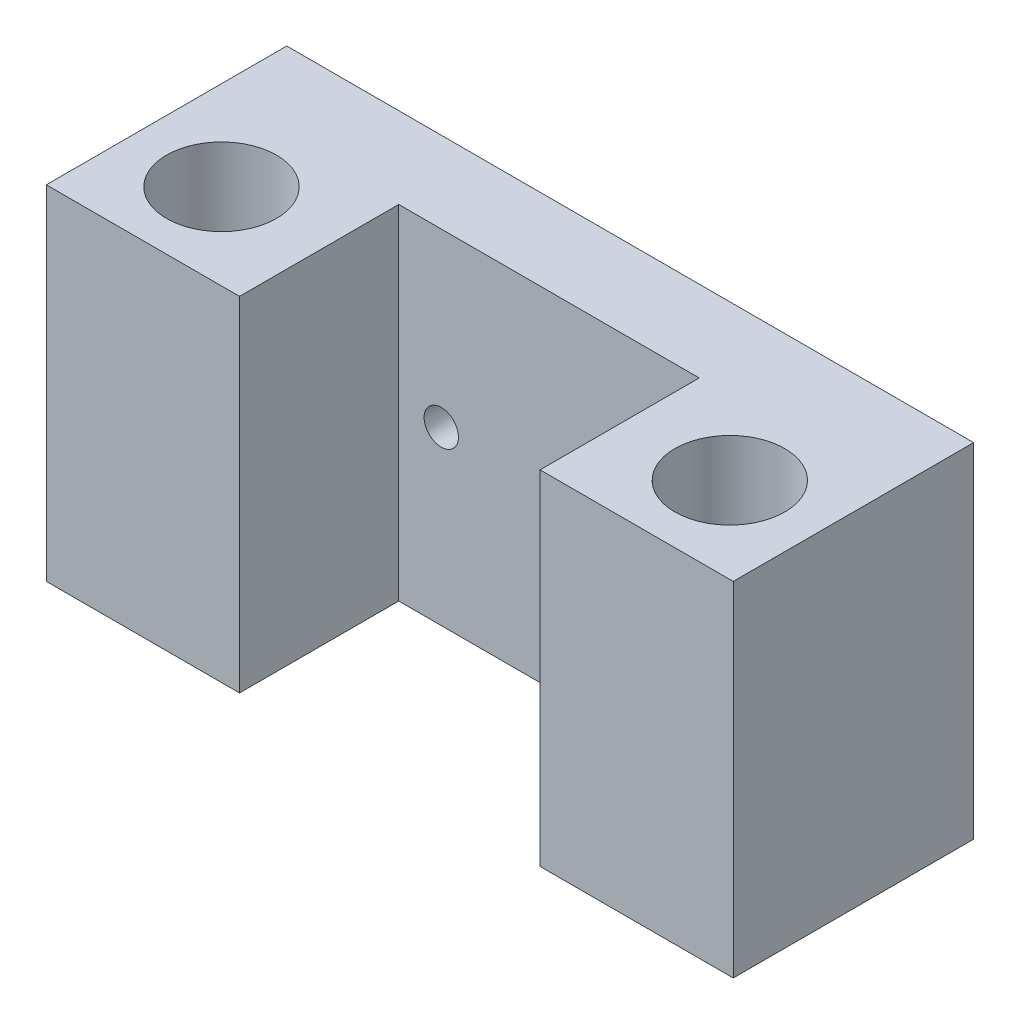
from build123d import *

# Parameters (mm, degrees)
SKETCH3_W           = 100
SKETCH3_H           = 50
BOSS_EXTRUDE1_DEPTH = 25
SKETCH5_R           = 8
SKETCH5_W           = 43.746020772
SKETCH5_H           = 23.175190528
CUT_EXTRUDE1_DEPTH  = 76
SKETCH7_R           = 2.5
CUT_EXTRUDE4_DEPTH  = 10
BOSS_EXTRUDE2_START = 10
SKETCH8_W           = 100
SKETCH8_H           = 50
SKETCH8_R           = 2.5
BOSS_EXTRUDE2_DEPTH = 10
SKETCH9_R           = 2.5
CUT_EXTRUDE5_DEPTH  = 10


with BuildPart() as part:
    # Sketch3 → Boss-Extrude1 (new body)
    with BuildSketch(Plane.XY):
        Rectangle(SKETCH3_W, SKETCH3_H)
    extrude(amount=BOSS_EXTRUDE1_DEPTH)

    # Sketch5 → Cut-Extrude1 (cut, through all)
    with BuildSketch(Plane(origin=(0, 25, 0), x_dir=(1, 0, 0), z_dir=(0, 1, 0))):
        with Locations(Location((37, -12.5, 0), (0, 0, 270))):
            Circle(SKETCH5_R)
        with Locations(Location((-37, -12.5, 0), (0, 0, 90))):
            Circle(SKETCH5_R)
        with Locations((0, -13.412404736)):
            Rectangle(SKETCH5_W, SKETCH5_H)
    extrude(amount=-CUT_EXTRUDE1_DEPTH, mode=Mode.SUBTRACT)

    # Sketch7 → Cut-Extrude4 (cut)
    with BuildSketch(Plane(origin=(0, 0, 0), x_dir=(-1, 0, 0), z_dir=(0, 0, -1))):
        with Locations((32.5, 9.25)):
            Circle(SKETCH7_R)
        with Locations((32.5, -9.25)):
            Circle(SKETCH7_R)
        with Locations((-32.5, -9.25)):
            Circle(SKETCH7_R)
        with Locations((-32.5, 9.25)):
            Circle(SKETCH7_R)
    extrude(amount=-CUT_EXTRUDE4_DEPTH, mode=Mode.SUBTRACT)

    # Sketch8 → Boss-Extrude2 (add)
    with BuildSketch(Plane(origin=(0, 0, 0), x_dir=(-1, 0, 0), z_dir=(0, 0, -1)).offset(BOSS_EXTRUDE2_START)):
        Rectangle(SKETCH8_W, SKETCH8_H)
        with Locations((-32.5, 9.25)):
            Circle(SKETCH8_R, mode=Mode.SUBTRACT)
        with Locations((-32.5, -9.25)):
            Circle(SKETCH8_R, mode=Mode.SUBTRACT)
        with Locations((32.5, -9.25)):
            Circle(SKETCH8_R, mode=Mode.SUBTRACT)
        with Locations((32.5, 9.25)):
            Circle(SKETCH8_R, mode=Mode.SUBTRACT)
    extrude(amount=-BOSS_EXTRUDE2_DEPTH)

    # Sketch9 → Cut-Extrude5 (cut)
    with BuildSketch(Plane.XY.offset(1.824809472)):
        with Locations((-15.68, 0)):
            Circle(SKETCH9_R)
        with Locations(Location((15.68, 0, 0), (0, 0, 180))):
            Circle(SKETCH9_R)
    extrude(amount=-CUT_EXTRUDE5_DEPTH, mode=Mode.SUBTRACT)


solid = part.part
